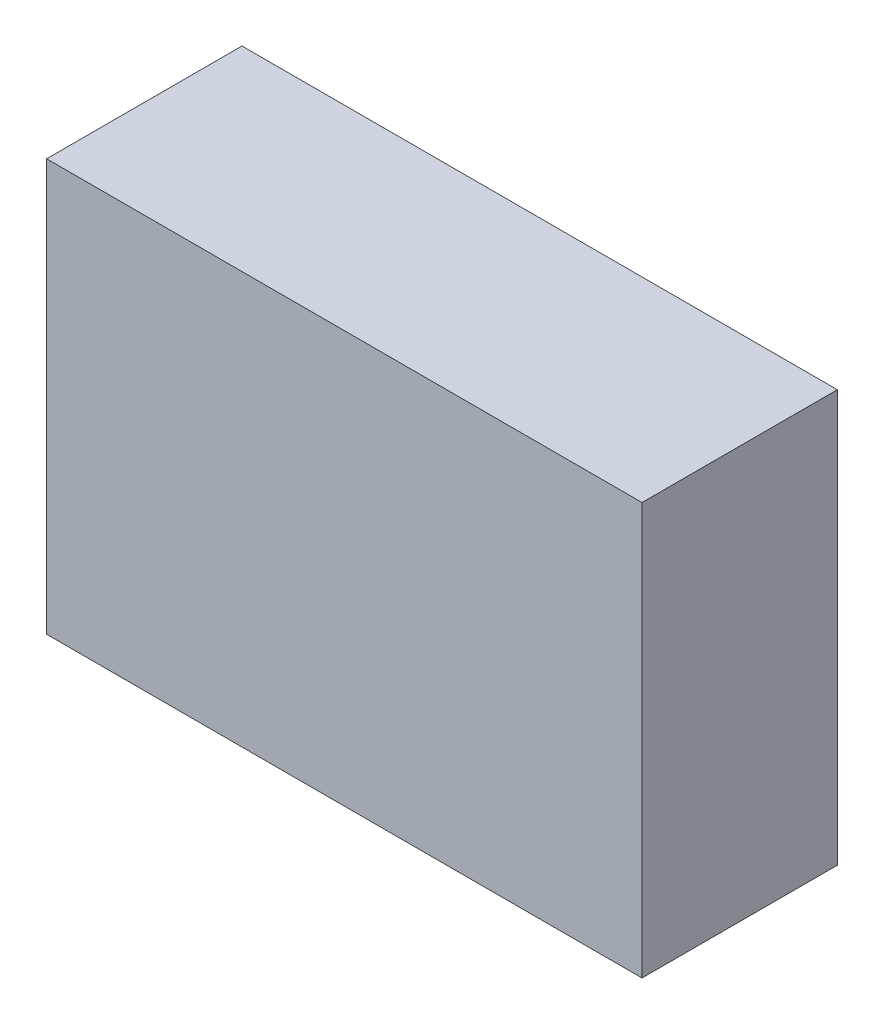
from build123d import *

# Parameters (mm, degrees)
SKETCH1_W               = 3.048
SKETCH1_H               = 2.1082
COMPONENT_OUTLINE_DEPTH = 1


with BuildPart() as part:
    # Sketch1 → Component_Outline (new body)
    with BuildSketch(Plane.XY):
        with Locations((0, -0.0381)):
            Rectangle(SKETCH1_W, SKETCH1_H)
    extrude(amount=COMPONENT_OUTLINE_DEPTH)


solid = part.part
